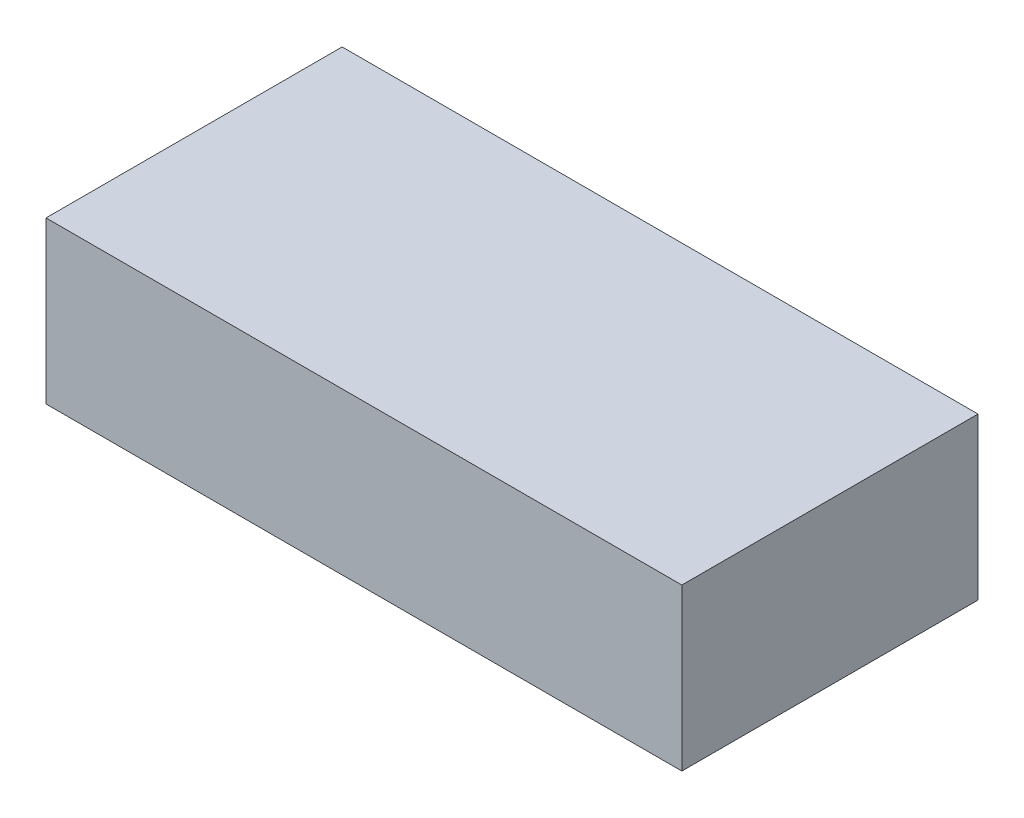
from build123d import *

# Parameters (mm, degrees)
SKETCH2_W           = 73
SKETCH2_H           = 34
BOSS_EXTRUDE2_DEPTH = 18.5


with BuildPart() as part:
    # Sketch2 → Boss-Extrude2 (new body)
    with BuildSketch(Plane(origin=(0, 0, 0), x_dir=(1, 0, 0), z_dir=(0, 1, 0))):
        Rectangle(SKETCH2_W, SKETCH2_H)
    extrude(amount=BOSS_EXTRUDE2_DEPTH)


solid = part.part
